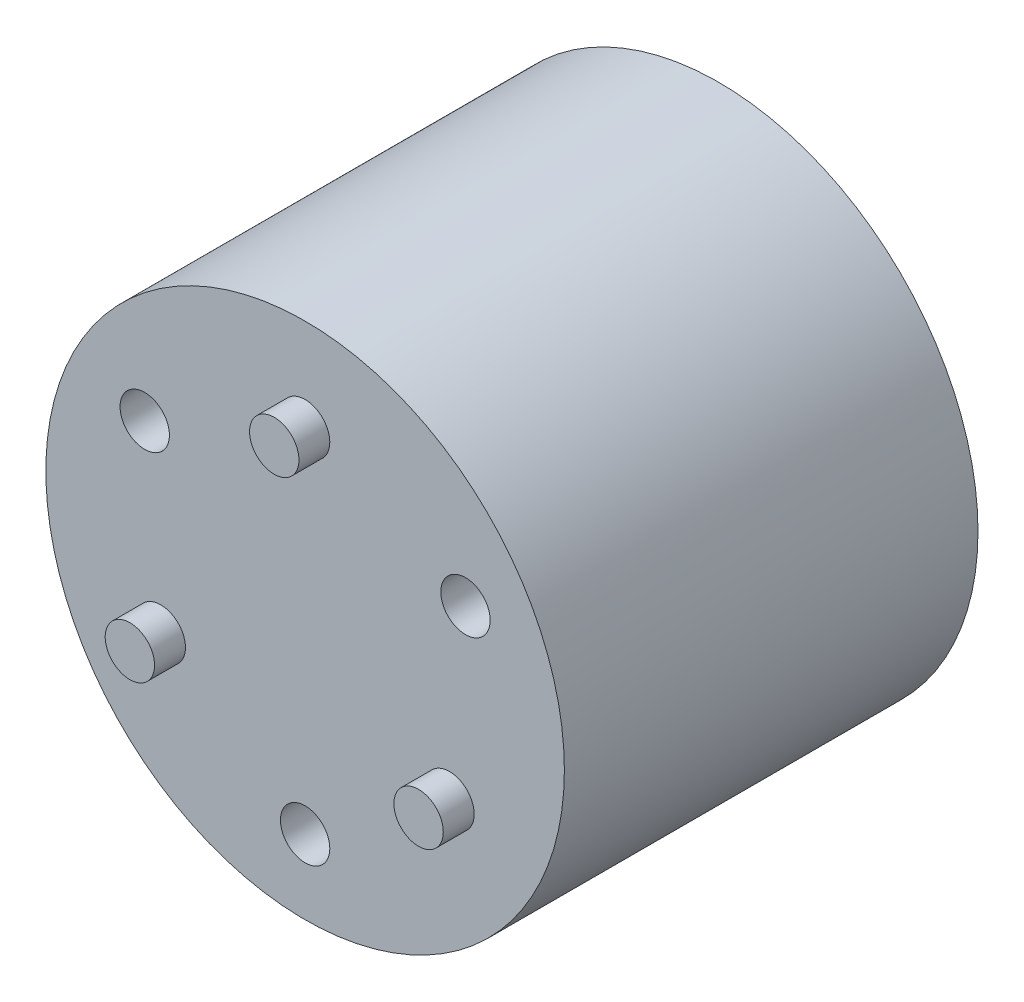
from build123d import *

# Parameters (mm, degrees)
SKETCH2_R           = 21
BOSS_EXTRUDE1_DEPTH = 33.5
SKETCH3_R           = 2
CUT_EXTRUDE2_DEPTH  = 4
SKETCH4_R           = 2
BOSS_EXTRUDE2_DEPTH = 2.5


with BuildPart() as part:
    # Sketch2 → Boss-Extrude1 (new body)
    with BuildSketch(Plane.XY):
        Circle(SKETCH2_R)
    extrude(amount=-BOSS_EXTRUDE1_DEPTH)

    # Sketch3 → Cut-Extrude2 (cut)
    with BuildSketch(Plane.XY):
        with Locations((0, -15)):
            Circle(SKETCH3_R)
        with Locations((-12.990381057, 7.5)):
            Circle(SKETCH3_R)
        with Locations((12.990381057, 7.5)):
            Circle(SKETCH3_R)
    extrude(amount=-CUT_EXTRUDE2_DEPTH, mode=Mode.SUBTRACT)

    # Sketch4 → Boss-Extrude2 (add)
    with BuildSketch(Plane.XY):
        with Locations((0, 13.5)):
            Circle(SKETCH4_R)
        with Locations((11.691342951, -6.75)):
            Circle(SKETCH4_R)
        with Locations((-11.691342951, -6.75)):
            Circle(SKETCH4_R)
    extrude(amount=BOSS_EXTRUDE2_DEPTH)


solid = part.part
